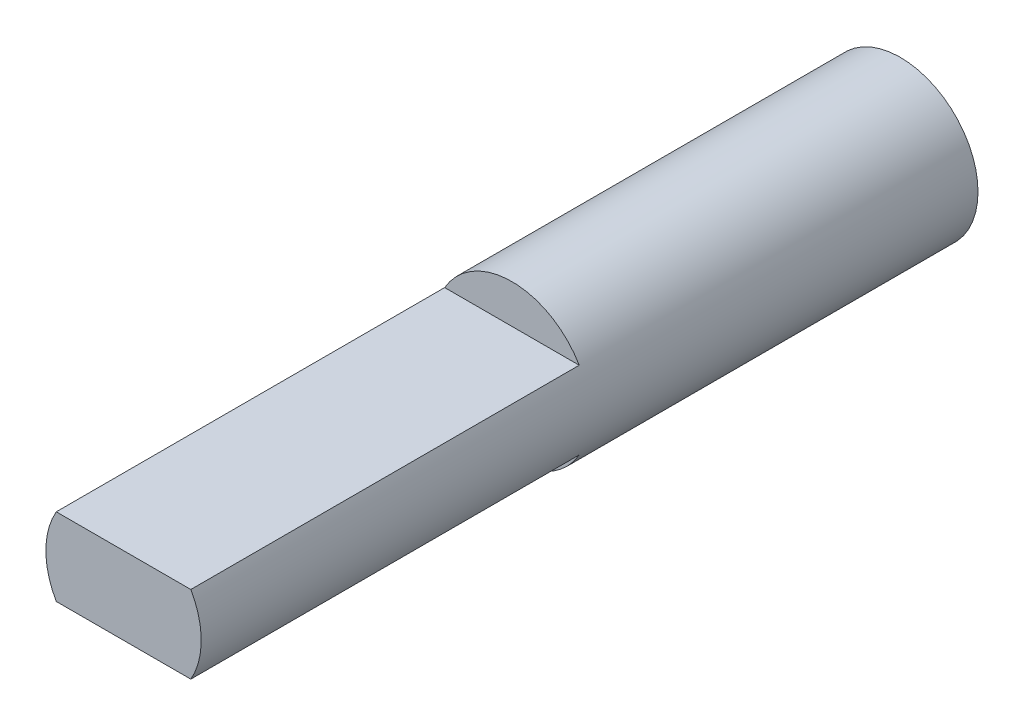
from build123d import *
from build123d.topology import SkipClean

# Parameters (mm, degrees)
SKETCH_1_R      = 1
EXTRUDE_1_DEPTH = 5
EXTRUDE_2_DEPTH = 5


with BuildPart() as part:
    # 草图1 → 凸台-拉伸1 (new body)
    with BuildSketch(Plane.XY):
        with Locations((-12.637856913, 12.301005314)):
            Circle(SKETCH_1_R)
    extrude(amount=EXTRUDE_1_DEPTH)

    # 草图2 → 凸台-拉伸2 (add)
    with SkipClean():  # the faces are left unmerged after this step: merging them gives an invalid solid
        with BuildSketch(Plane.XY.offset(5)):
            with BuildLine():
                Line((-13.503882317, 12.801005314), (-11.771831509, 12.801005314))
                ThreePointArc((-11.771831509, 12.801005314), (-11.637856913, 12.301005314), (-11.771831509, 11.801005314))
                Line((-11.771831509, 11.801005314), (-13.503882317, 11.801005314))
                ThreePointArc((-13.503882317, 11.801005314), (-13.637856913, 12.301005314), (-13.503882317, 12.801005314))
            make_face()
        extrude(amount=EXTRUDE_2_DEPTH)


solid = part.part
